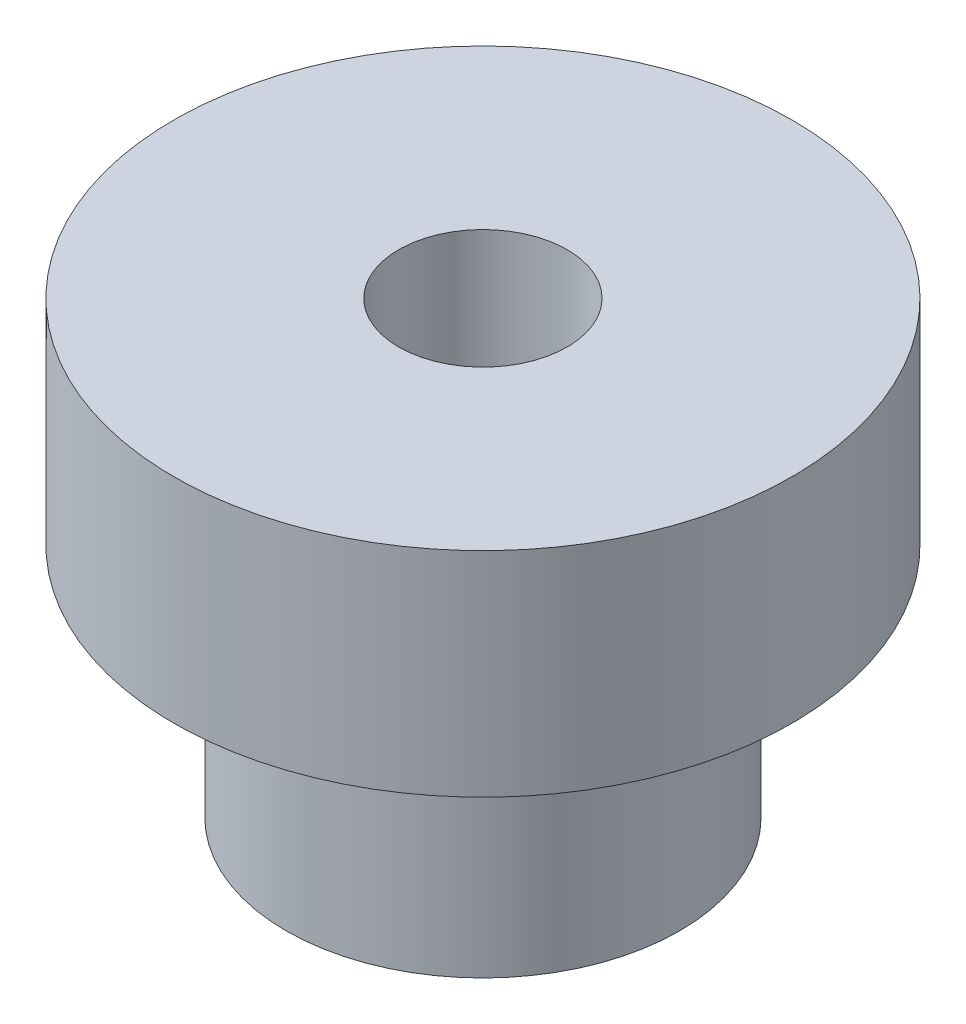
from build123d import *

# Parameters (mm, degrees)
SKETCH1_R           = 5.5
BOSS_EXTRUDE1_DEPTH = 3.8
SKETCH2_R           = 3.5
BOSS_EXTRUDE2_DEPTH = 4.2
SKETCH3_R           = 1.5
CUT_EXTRUDE1_DEPTH  = 12.157956802


with BuildPart() as part:
    # Sketch1 → Boss-Extrude1 (new body)
    with BuildSketch(Plane(origin=(0, 0, 0), x_dir=(1, 0, 0), z_dir=(0, 1, 0))):
        with Locations(Location((0, 0, 0), (0, 0, 90))):
            Circle(SKETCH1_R)
    extrude(amount=BOSS_EXTRUDE1_DEPTH)

    # Sketch2 → Boss-Extrude2 (add)
    with BuildSketch(Plane.XZ):
        with Locations(Location((0, 0, 0), (0, 0, 90))):
            Circle(SKETCH2_R)
    extrude(amount=BOSS_EXTRUDE2_DEPTH)

    # Sketch3 → Cut-Extrude1 (cut, through all)
    with BuildSketch(Plane(origin=(0, 3.8, 0), x_dir=(1, 0, 0), z_dir=(0, 1, 0))):
        with Locations(Location((0, 0, 0), (0, 0, 270))):
            Circle(SKETCH3_R)
    extrude(amount=-CUT_EXTRUDE1_DEPTH, mode=Mode.SUBTRACT)


solid = part.part
